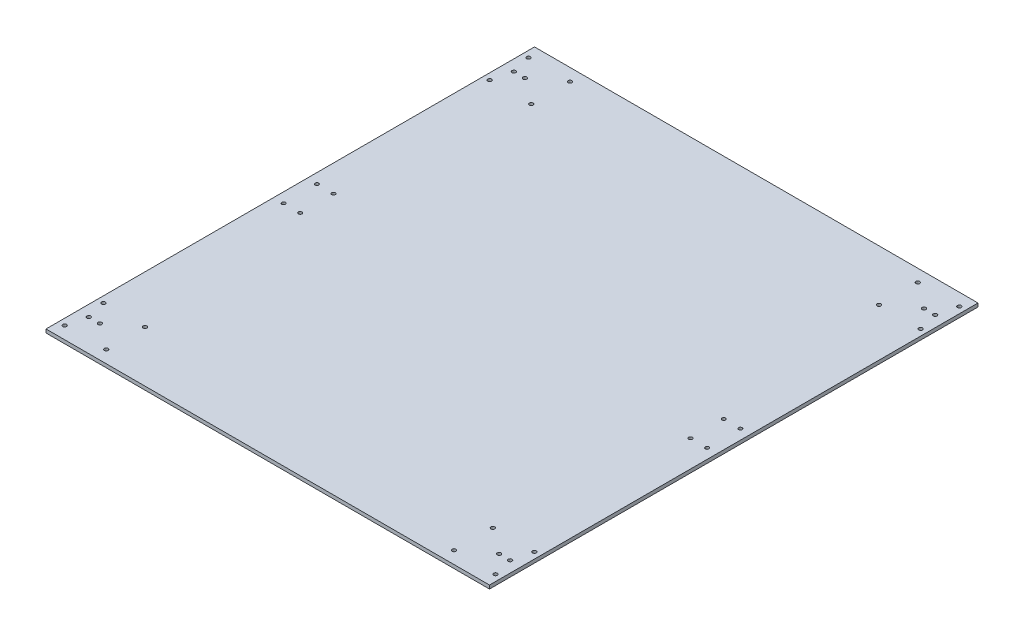
from build123d import *

# Parameters (mm, degrees)
SKETCH1_W            = 400
SKETCH1_H            = 440.6
BOSS_EXTRUDE1_DEPTH  = 3.175
SKETCH2_R            = 1.7
CUT_EXTRUDE1_DEPTH   = 298.560364674
M3_CLEARANCE_HOLE1_D = 3.2


with BuildPart() as part:
    # Sketch1 → Boss-Extrude1 (new body)
    with BuildSketch(Plane(origin=(0, 0, 0), x_dir=(1, 0, 0), z_dir=(0, 1, 0))):
        Rectangle(SKETCH1_W, SKETCH1_H)
    extrude(amount=BOSS_EXTRUDE1_DEPTH)

    # Sketch2 → Cut-Extrude1 (cut, through all)
    with BuildSketch(Plane(origin=(0, 3.175, 0), x_dir=(1, 0, 0), z_dir=(0, 1, 0))):
        with Locations(Location((-156.861792453, 174.15, 0), (0, 0, 270))):
            Circle(SKETCH2_R)
        with Locations(Location((-194.338207547, 174.15, 0), (0, 0, 270))):
            Circle(SKETCH2_R)
        with Locations(Location((-156.861792453, 209.15, 0), (0, 0, 270))):
            Circle(SKETCH2_R)
        with Locations(Location((-194.338207547, 209.15, 0), (0, 0, 270))):
            Circle(SKETCH2_R)
        with Locations(Location((-156.861792453, -209.15, 0), (0, 0, 270))):
            Circle(SKETCH2_R)
        with Locations(Location((-194.338207547, -209.15, 0), (0, 0, 270))):
            Circle(SKETCH2_R)
        with Locations(Location((-156.861792453, -174.15, 0), (0, 0, 270))):
            Circle(SKETCH2_R)
        with Locations(Location((-194.338207547, -174.15, 0), (0, 0, 270))):
            Circle(SKETCH2_R)
        with Locations(Location((194.338207547, -174.15, 0), (0, 0, 270))):
            Circle(SKETCH2_R)
        with Locations(Location((156.861792453, -174.15, 0), (0, 0, 270))):
            Circle(SKETCH2_R)
        with Locations(Location((194.338207547, -209.15, 0), (0, 0, 270))):
            Circle(SKETCH2_R)
        with Locations(Location((156.861792453, -209.15, 0), (0, 0, 270))):
            Circle(SKETCH2_R)
        with Locations(Location((194.338207547, 174.15, 0), (0, 0, 270))):
            Circle(SKETCH2_R)
        with Locations(Location((194.338207547, 209.15, 0), (0, 0, 270))):
            Circle(SKETCH2_R)
        with Locations(Location((156.861792453, 174.15, 0), (0, 0, 270))):
            Circle(SKETCH2_R)
        with Locations(Location((156.861792453, 209.15, 0), (0, 0, 270))):
            Circle(SKETCH2_R)
        with BuildLine():
            ThreePointArc((-181.7, 191.650000004), (-181.681096823, 191.397188868), (-181.624807682, 191.150000006))
            ThreePointArc((-181.624807682, 191.150000006), (-180, 189.950000004), (-178.375192318, 191.150000006))
            ThreePointArc((-178.375192318, 191.150000006), (-178.318903177, 191.397188868), (-178.3, 191.650000004))
            ThreePointArc((-178.3, 191.650000004), (-178.318903177, 191.90281114), (-178.375192318, 192.150000002))
            ThreePointArc((-178.375192318, 192.150000002), (-180, 193.350000004), (-181.624807682, 192.150000002))
            ThreePointArc((-181.624807682, 192.150000002), (-181.681096823, 191.90281114), (-181.7, 191.650000004))
        make_face()
        with BuildLine():
            ThreePointArc((-188.375192318, 192.150000002), (-190, 193.350000004), (-191.624807682, 192.150000002))
            ThreePointArc((-191.624807682, 192.150000002), (-191.681096823, 191.90281114), (-191.7, 191.650000004))
            ThreePointArc((-191.7, 191.650000004), (-191.681096823, 191.397188868), (-191.624807682, 191.150000006))
            ThreePointArc((-191.624807682, 191.150000006), (-190, 189.950000004), (-188.375192318, 191.150000006))
            ThreePointArc((-188.375192318, 191.150000006), (-188.318903177, 191.397188868), (-188.3, 191.650000004))
            ThreePointArc((-188.3, 191.650000004), (-188.318903177, 191.90281114), (-188.375192318, 192.150000002))
        make_face()
        with BuildLine():
            ThreePointArc((-178.375192318, -192.150000002), (-178.318903177, -191.90281114), (-178.3, -191.650000004))
            ThreePointArc((-178.3, -191.650000004), (-178.318903177, -191.397188868), (-178.375192318, -191.150000006))
            ThreePointArc((-178.375192318, -191.150000006), (-180, -189.950000004), (-181.624807682, -191.150000006))
            ThreePointArc((-181.624807682, -191.150000006), (-181.681096823, -191.397188868), (-181.7, -191.650000004))
            ThreePointArc((-181.7, -191.650000004), (-181.681096823, -191.90281114), (-181.624807682, -192.150000002))
            ThreePointArc((-181.624807682, -192.150000002), (-180, -193.350000004), (-178.375192318, -192.150000002))
        make_face()
        with BuildLine():
            ThreePointArc((-191.624807682, -192.150000002), (-190, -193.350000004), (-188.375192318, -192.150000002))
            ThreePointArc((-188.375192318, -192.150000002), (-188.318903177, -191.90281114), (-188.3, -191.650000004))
            ThreePointArc((-188.3, -191.650000004), (-188.318903177, -191.397188868), (-188.375192318, -191.150000006))
            ThreePointArc((-188.375192318, -191.150000006), (-190, -189.950000004), (-191.624807682, -191.150000006))
            ThreePointArc((-191.624807682, -191.150000006), (-191.681096823, -191.397188868), (-191.7, -191.650000004))
            ThreePointArc((-191.7, -191.650000004), (-191.681096823, -191.90281114), (-191.624807682, -192.150000002))
        make_face()
        with BuildLine():
            ThreePointArc((191.624807682, -192.150000002), (191.681096823, -191.90281114), (191.7, -191.650000004))
            ThreePointArc((191.7, -191.650000004), (191.681096823, -191.397188868), (191.624807682, -191.150000006))
            ThreePointArc((191.624807682, -191.150000006), (190, -189.950000004), (188.375192318, -191.150000006))
            ThreePointArc((188.375192318, -191.150000006), (188.318903177, -191.397188868), (188.3, -191.650000004))
            ThreePointArc((188.3, -191.650000004), (188.318903177, -191.90281114), (188.375192318, -192.150000002))
            ThreePointArc((188.375192318, -192.150000002), (190, -193.350000004), (191.624807682, -192.150000002))
        make_face()
        with BuildLine():
            ThreePointArc((181.624807682, -192.150000002), (181.681096823, -191.90281114), (181.7, -191.650000004))
            ThreePointArc((181.7, -191.650000004), (181.681096823, -191.397188868), (181.624807682, -191.150000006))
            ThreePointArc((181.624807682, -191.150000006), (180, -189.950000004), (178.375192318, -191.150000006))
            ThreePointArc((178.375192318, -191.150000006), (178.318903177, -191.397188868), (178.3, -191.650000004))
            ThreePointArc((178.3, -191.650000004), (178.318903177, -191.90281114), (178.375192318, -192.150000002))
            ThreePointArc((178.375192318, -192.150000002), (180, -193.350000004), (181.624807682, -192.150000002))
        make_face()
        with BuildLine():
            ThreePointArc((188.375192318, 192.150000002), (188.318903177, 191.90281114), (188.3, 191.650000004))
            ThreePointArc((188.3, 191.650000004), (188.318903177, 191.397188868), (188.375192318, 191.150000006))
            ThreePointArc((188.375192318, 191.150000006), (190, 189.950000004), (191.624807682, 191.150000006))
            ThreePointArc((191.624807682, 191.150000006), (191.681096823, 191.397188868), (191.7, 191.650000004))
            ThreePointArc((191.7, 191.650000004), (191.681096823, 191.90281114), (191.624807682, 192.150000002))
            ThreePointArc((191.624807682, 192.150000002), (190, 193.350000004), (188.375192318, 192.150000002))
        make_face()
        with BuildLine():
            ThreePointArc((181.624807682, 191.150000006), (181.681096823, 191.397188868), (181.7, 191.650000004))
            ThreePointArc((181.7, 191.650000004), (181.681096823, 191.90281114), (181.624807682, 192.150000002))
            ThreePointArc((181.624807682, 192.150000002), (180, 193.350000004), (178.375192318, 192.150000002))
            ThreePointArc((178.375192318, 192.150000002), (178.318903177, 191.90281114), (178.3, 191.650000004))
            ThreePointArc((178.3, 191.650000004), (178.318903177, 191.397188868), (178.375192318, 191.150000006))
            ThreePointArc((178.375192318, 191.150000006), (180, 189.950000004), (181.624807682, 191.150000006))
        make_face()
    extrude(amount=-CUT_EXTRUDE1_DEPTH, mode=Mode.SUBTRACT)

    # M3 Clearance Hole1 (through all)
    with Locations(Plane(origin=(0, 0, 0), x_dir=(-1, 0, 0), z_dir=(0, -1, 0))):
        with Locations((-176, -15), (-191, 15), (-191, -15), (-176, 15), (191, -15), (176, 15), (176, -15), (191, 15)):
            Hole(M3_CLEARANCE_HOLE1_D / 2)


solid = part.part
